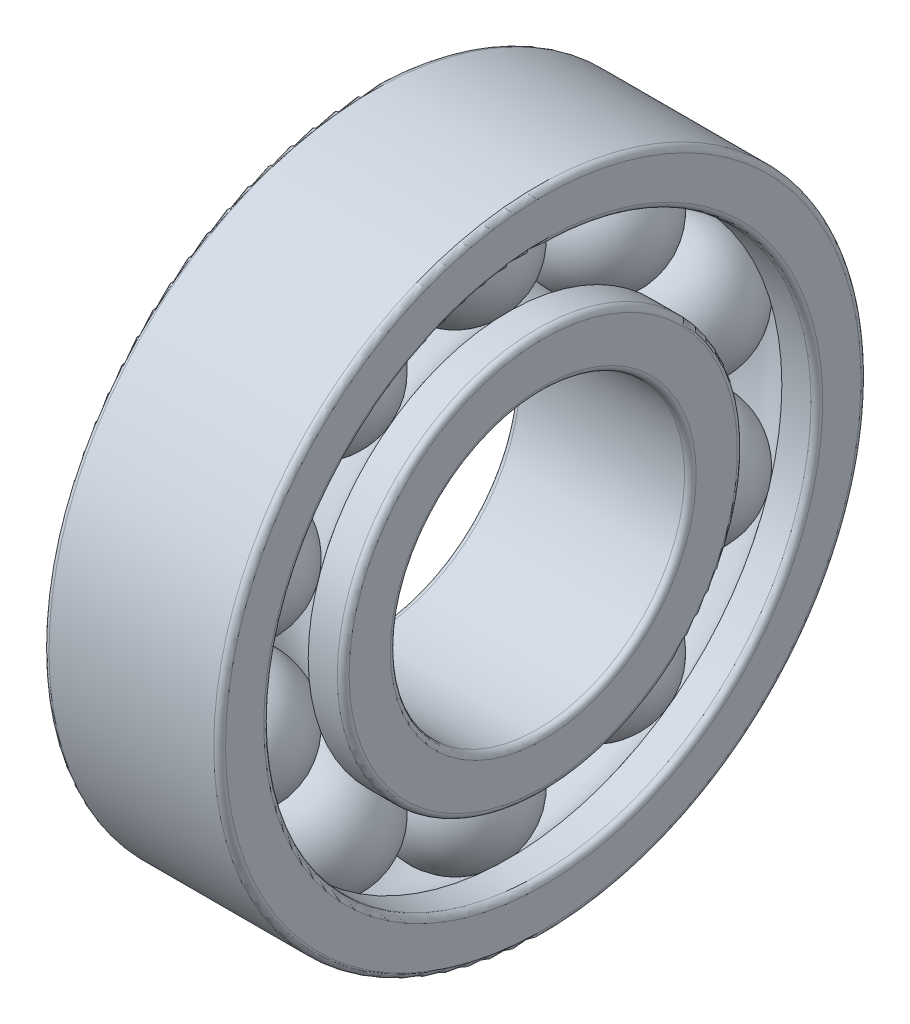
from build123d import *

# Parameters (mm, degrees)
CIRPATTERN1_COUNT = 10


with BuildPart() as part:
    # Sketch1 → Revolve1 (revolve)
    with BuildSketch(Plane.XY, mode=Mode.PRIVATE) as revolve1_sk:
        with BuildLine():
            Line((1.5, 2.6), (1.5, 3.3))
            ThreePointArc((1.5, 3.3), (1.470710678, 3.370710678), (1.4, 3.4))
            Line((1.4, 3.4), (0.90519335, 3.4))
            ThreePointArc((0.90519335, 3.4), (0, 2.925), (-0.90519335, 3.4))
            Line((-0.90519335, 3.4), (-1.4, 3.4))
            ThreePointArc((-1.4, 3.4), (-1.470710678, 3.370710678), (-1.5, 3.3))
            Line((-1.5, 3.3), (-1.5, 2.6))
            ThreePointArc((-1.5, 2.6), (-1.470710678, 2.529289322), (-1.4, 2.5))
            Line((-1.4, 2.5), (1.4, 2.5))
            ThreePointArc((1.4, 2.5), (1.470710678, 2.529289322), (1.5, 2.6))
        make_face()
        with BuildLine():
            Line((-1.4, 5.5), (1.4, 5.5))
            ThreePointArc((1.4, 5.5), (1.470710678, 5.470710678), (1.5, 5.4))
            Line((1.5, 5.4), (1.5, 4.75))
            ThreePointArc((1.5, 4.75), (1.470710678, 4.679289322), (1.4, 4.65))
            Line((1.4, 4.65), (0.90519335, 4.65))
            ThreePointArc((0.90519335, 4.65), (0, 5.125), (-0.90519335, 4.65))
            Line((-0.90519335, 4.65), (-1.4, 4.65))
            ThreePointArc((-1.4, 4.65), (-1.470710678, 4.679289322), (-1.5, 4.75))
            Line((-1.5, 4.75), (-1.5, 5.4))
            ThreePointArc((-1.5, 5.4), (-1.470710678, 5.470710678), (-1.4, 5.5))
        make_face()
    revolve(revolve1_sk.sketch.rotate(Axis((-11.057742782, 0, 0), (1, 0, 0)), 90), axis=Axis((-11.057742782, 0, 0), (1, 0, 0)))


with BuildPart() as body_2:
    # Sketch2 → Revolve2 (revolve)
    with BuildSketch(Plane.XY):
        with BuildLine():
            Line((0, 2.925), (0, 5.125))
            ThreePointArc((0, 5.125), (1.1, 4.025), (0, 2.925))
        make_face()
    revolve(axis=Axis((0, 2.925, 0), (0, 1, 0)))


with BuildPart() as cirpattern1_1:
    # CirPattern1: pattern copy
    add(body_2.part.rotate(Axis((0, 0, 0), (1, 0, 0)), 1 * 360 / CIRPATTERN1_COUNT))


with BuildPart() as cirpattern1_2:
    # CirPattern1: pattern copy
    add(body_2.part.rotate(Axis((0, 0, 0), (1, 0, 0)), 2 * 360 / CIRPATTERN1_COUNT))


with BuildPart() as cirpattern1_3:
    # CirPattern1: pattern copy
    add(body_2.part.rotate(Axis((0, 0, 0), (1, 0, 0)), 3 * 360 / CIRPATTERN1_COUNT))


with BuildPart() as cirpattern1_4:
    # CirPattern1: pattern copy
    add(body_2.part.rotate(Axis((0, 0, 0), (1, 0, 0)), 4 * 360 / CIRPATTERN1_COUNT))


with BuildPart() as cirpattern1_5:
    # CirPattern1: pattern copy
    add(body_2.part.rotate(Axis((0, 0, 0), (1, 0, 0)), 5 * 360 / CIRPATTERN1_COUNT))


with BuildPart() as cirpattern1_6:
    # CirPattern1: pattern copy
    add(body_2.part.rotate(Axis((0, 0, 0), (1, 0, 0)), 6 * 360 / CIRPATTERN1_COUNT))


with BuildPart() as cirpattern1_7:
    # CirPattern1: pattern copy
    add(body_2.part.rotate(Axis((0, 0, 0), (1, 0, 0)), 7 * 360 / CIRPATTERN1_COUNT))


with BuildPart() as cirpattern1_8:
    # CirPattern1: pattern copy
    add(body_2.part.rotate(Axis((0, 0, 0), (1, 0, 0)), 8 * 360 / CIRPATTERN1_COUNT))


with BuildPart() as cirpattern1_9:
    # CirPattern1: pattern copy
    add(body_2.part.rotate(Axis((0, 0, 0), (1, 0, 0)), 9 * 360 / CIRPATTERN1_COUNT))


solid = Compound([part.part, body_2.part, cirpattern1_1.part, cirpattern1_2.part, cirpattern1_3.part, cirpattern1_4.part, cirpattern1_5.part, cirpattern1_6.part, cirpattern1_7.part, cirpattern1_8.part, cirpattern1_9.part])
